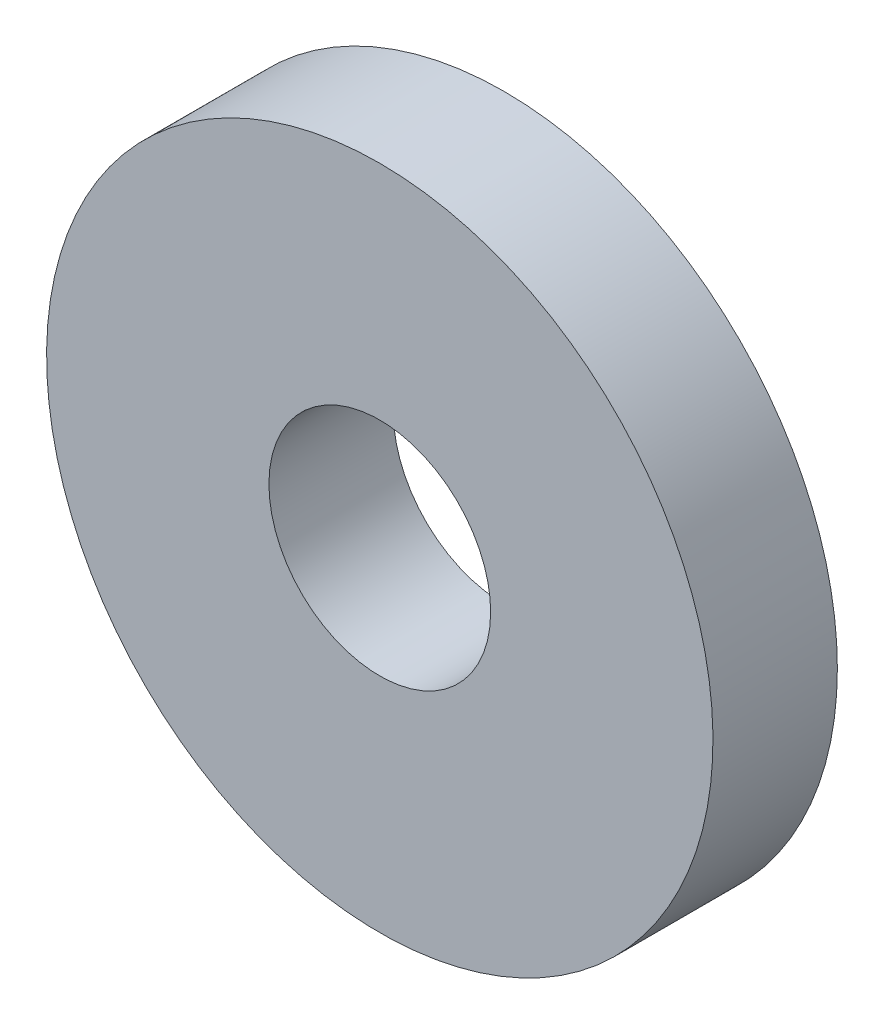
from build123d import *

# Parameters (mm, degrees)
SKETCH1_R           = 7.5
SKETCH1_R_2         = 2.495506105
BOSS_EXTRUDE1_DEPTH = 2.8


with BuildPart() as part:
    # Sketch1 → Boss-Extrude1 (new body)
    with BuildSketch(Plane.XY):
        with Locations(Location((0, 0, 0), (0, 0, 90))):
            Circle(SKETCH1_R)
        with Locations(Location((0, 0, 0), (0, 0, 219.459064239))):
            Circle(SKETCH1_R_2, mode=Mode.SUBTRACT)
    extrude(amount=BOSS_EXTRUDE1_DEPTH)


solid = part.part
